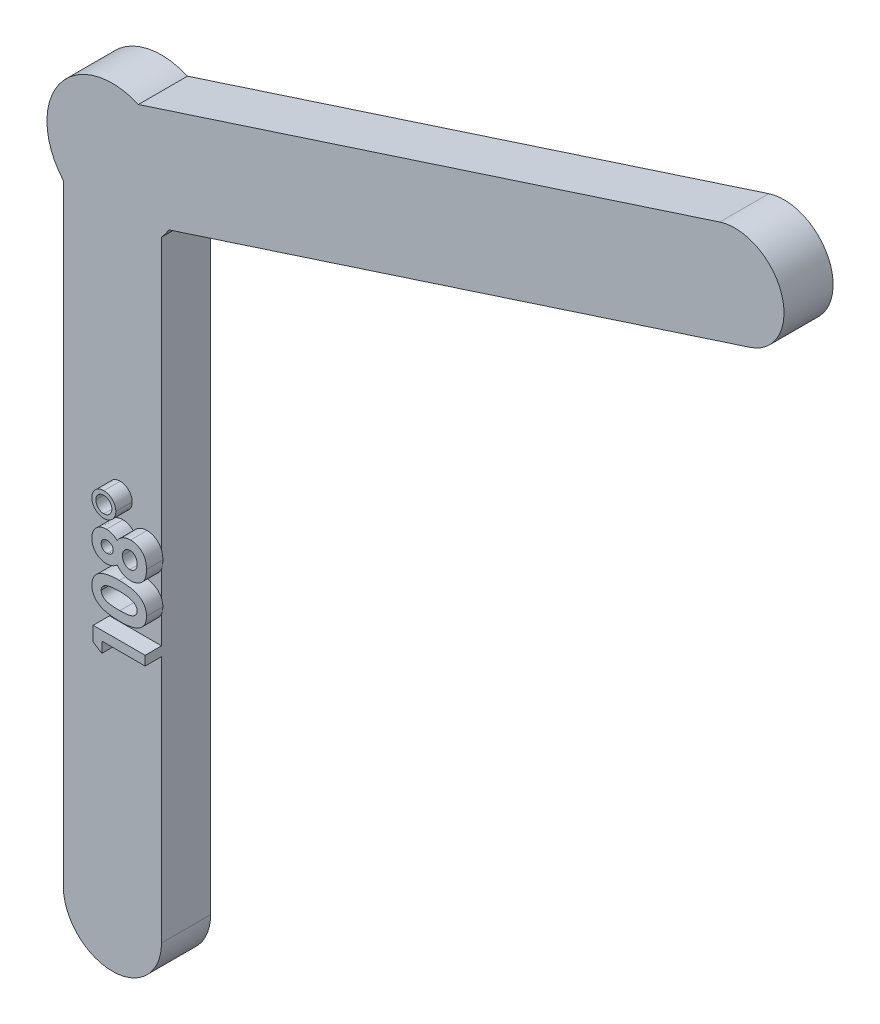
from build123d import *

# Parameters (mm, degrees)
BOSS_EXTRUDE1_DEPTH = 3
BOSS_EXTRUDE2_DEPTH = 1


with BuildPart() as part:
    # Sketch2 → Boss-Extrude1 (new body)
    with BuildSketch(Plane.XY):
        with BuildLine():
            Line((-3, -40), (-3, -2.645751311))
            ThreePointArc((-3, -2.645751311), (-3.236067977, 2.351141009), (1.589208042, 3.670751667))
            Line((1.589208042, 3.670751667), (37.115209669, 15.213849324))
            ThreePointArc((37.115209669, 15.213849324), (40.895430201, 13.287730758), (38.969311635, 9.507510226))
            Line((38.969311635, 9.507510226), (3.443310008, -2.035587431))
            ThreePointArc((3.443310008, -2.035587431), (3.236067977, -2.351141009), (3, -2.645751311))
            Line((3, -2.645751311), (3, -40))
            ThreePointArc((3, -40), (0, -43), (-3, -40))
        make_face()
    extrude(amount=BOSS_EXTRUDE1_DEPTH)

    # Sketch3 → Boss-Extrude2 (add)
    # profile 1 of 4: a face of its own
    with BuildSketch(Plane.XY.offset(3)):
        Polygon((-0.175, -25.154881865), (-0.175, -24.27399745), (3, -24.27399745), (3, -24.843869245), (0.354166667, -24.843869245), (0.354166667, -25.495151297), align=None)
    # profile 2 of 4: a face of its own
    with BuildSketch(Plane.XY.offset(3)):
        with BuildLine():
            add(Edge.make_bspline(
                [(-0.256410256, -22.187223612), (-0.256000846, -22.159639409), (-0.255195836, -22.105401495), (-0.246473924, -22.02552), (-0.233303758, -21.948569182), (-0.214913964, -21.874261296), (-0.19065475, -21.803082912), (-0.161374324, -21.734785029), (-0.126796317, -21.669429262), (-0.086761751, -21.606946387), (-0.040652473, -21.547894496), (0.010185802, -21.491318806), (0.067717809, -21.43948776), (0.130454644, -21.390835172), (0.198771401, -21.345693322), (0.272469109, -21.303770681), (0.352002612, -21.265485151), (0.437488797, -21.230380098), (0.530216664, -21.198990657), (0.631247648, -21.172550921), (0.740605462, -21.149874557), (0.858562124, -21.130734067), (0.985274483, -21.11626696), (1.120658341, -21.106515836), (1.264452704, -21.099824155), (1.363094454, -21.099278026), (1.413772035, -21.09899745)],
                knots=[0, 0, 0, 0, 0.879187688, 1.728717895, 2.558878706, 3.367146394, 4.166631857, 4.95393622, 5.734098362, 6.521634849, 7.316678452, 8.120609651, 8.943639266, 9.781961388, 10.650008082, 11.55217958, 12.483362701, 13.462505087, 14.497127373, 15.602264045, 16.790140859, 18.057036744, 19.411188506, 20.855078804, 22.384284574, 24, 24, 24, 24], degree=3))
            add(Edge.make_bspline(
                [(1.413772035, -21.09899745), (1.465083636, -21.099300727), (1.564781155, -21.099889987), (1.709890925, -21.106237126), (1.846257088, -21.117170742), (1.973869318, -21.131251658), (2.09264741, -21.150576911), (2.202741653, -21.173044562), (2.304172829, -21.200142384), (2.396949232, -21.232384739), (2.482667702, -21.267543829), (2.562361603, -21.305324879), (2.635439661, -21.347366311), (2.704216337, -21.389836589), (2.765684896, -21.437474644), (2.822263901, -21.486752984), (2.87178804, -21.540176006), (2.916848745, -21.595431785), (2.955788395, -21.654560868), (2.989844864, -21.716949245), (3.017468579, -21.783710325), (3.041494248, -21.853626861), (3.058742076, -21.927890678), (3.072427664, -22.005321711), (3.079991159, -22.086794149), (3.080929461, -22.142263866), (3.081410256, -22.170687154)],
                knots=[0, 0, 0, 0, 1.643824397, 3.193921316, 4.652018541, 6.026147715, 7.305813021, 8.506024873, 9.624771103, 10.66654028, 11.650369642, 12.592128821, 13.489360096, 14.35046321, 15.179132238, 15.977837183, 16.751455772, 17.509897991, 18.259653136, 19.016390304, 19.783391144, 20.571659993, 21.382176161, 22.223003704, 23.089447706, 24, 24, 24, 24], degree=3))
            add(Edge.make_bspline(
                [(3.081410256, -22.170687154), (3.080920089, -22.199109624), (3.079959859, -22.254788824), (3.072484978, -22.336482291), (3.058682809, -22.414321079), (3.041375575, -22.489181731), (3.017471846, -22.560488459), (2.989215292, -22.628874266), (2.954465748, -22.692986878), (2.915602853, -22.75414734), (2.870815661, -22.811389711), (2.820807888, -22.865562537), (2.766280514, -22.917423591), (2.705338818, -22.96512523), (2.639096011, -23.009520627), (2.567561271, -23.051080932), (2.490500768, -23.088961965), (2.40793533, -23.12443059), (2.317883816, -23.155810482), (2.21949947, -23.182869572), (2.112045503, -23.205788839), (1.995629446, -23.223802272), (1.870235813, -23.238328502), (1.735965212, -23.249100871), (1.592768059, -23.255486697), (1.494340976, -23.256069291), (1.443664864, -23.256369245)],
                knots=[0, 0, 0, 0, 0.917318694, 1.797013832, 2.644089644, 3.467281984, 4.274391433, 5.068665368, 5.852346333, 6.624865025, 7.405043053, 8.194438745, 9.002823433, 9.831034161, 10.688848002, 11.574933485, 12.499091769, 13.45866927, 14.473616003, 15.574277631, 16.749933499, 18.017757418, 19.374908438, 20.82337846, 22.364486432, 24, 24, 24, 24], degree=3))
            add(Edge.make_bspline(
                [(1.443664864, -23.256369245), (1.373254462, -23.255825542), (1.237396686, -23.25477646), (1.0411217, -23.241481718), (0.859699474, -23.22196841), (0.693433485, -23.193307983), (0.541707931, -23.15786976), (0.405522301, -23.112489271), (0.282992161, -23.060826886), (0.210404568, -23.016803896), (0.175445713, -22.995602018)],
                knots=[0, 0, 0, 0, 1.288568992, 2.486310467, 3.599230591, 4.627010532, 5.572937695, 6.447898582, 7.252493626, 8, 8, 8, 8], degree=3))
            add(Edge.make_bspline(
                [(0.175445713, -22.995602018), (0.141102145, -22.970949484), (0.073953702, -22.922748921), (-0.014199652, -22.838468891), (-0.089592717, -22.747920972), (-0.150519281, -22.649245361), (-0.198565973, -22.544002654), (-0.232500812, -22.431289289), (-0.252272829, -22.311521498), (-0.255010519, -22.229274958), (-0.256410256, -22.187223612)],
                knots=[0, 0, 0, 0, 1.058512271, 2.069600068, 3.047294572, 4.004278952, 4.967380941, 5.939006123, 6.946246673, 8, 8, 8, 8], degree=3))
        make_face()
        with BuildLine():
            add(Edge.make_bspline(
                [(0.313461538, -22.173231224), (0.314647089, -22.198164977), (0.316971398, -22.247048368), (0.336589396, -22.318024416), (0.367119772, -22.384663133), (0.402937146, -22.435915702), (0.437997174, -22.473843075), (0.469692245, -22.50046678), (0.505088209, -22.526130336), (0.5457633, -22.548770627), (0.590374583, -22.570366594), (0.639050565, -22.590819426), (0.692584041, -22.608406161), (0.750614615, -22.625179465), (0.814547313, -22.639686238), (0.884999784, -22.65237958), (0.962212565, -22.663193069), (1.046509296, -22.670991953), (1.137448259, -22.678152731), (1.235421604, -22.683308732), (1.340408748, -22.685459568), (1.412711585, -22.686144155), (1.45002504, -22.68649745)],
                knots=[0, 0, 0, 0, 1.076486532, 2.110485037, 3.16053299, 4.233735637, 4.798028448, 5.389657808, 6.0205397, 6.6857231, 7.399126456, 8.163539924, 8.966557062, 9.834164971, 10.774831688, 11.799768806, 12.928987201, 14.14492726, 15.459726247, 16.873396567, 18.386448164, 20, 20, 20, 20], degree=3))
            add(Edge.make_bspline(
                [(1.45002504, -22.68649745), (1.498366186, -22.685914523), (1.591063917, -22.684796717), (1.72437073, -22.678981137), (1.845884837, -22.667186388), (1.956076433, -22.652860272), (2.054303096, -22.632171296), (2.141437387, -22.608758289), (2.216697621, -22.579702468), (2.280987028, -22.546139154), (2.335677326, -22.508962718), (2.382164459, -22.468606882), (2.42242009, -22.42644467), (2.455119251, -22.381160293), (2.480178379, -22.33286173), (2.498203101, -22.281952199), (2.509236783, -22.228399345), (2.5107668, -22.191726903), (2.511538462, -22.173231224)],
                knots=[0, 0, 0, 0, 1.771738815, 3.39744054, 4.888007323, 6.245018868, 7.467093912, 8.564230264, 9.548241846, 10.417081984, 11.216594933, 11.965786359, 12.669352538, 13.348558586, 14.005353126, 14.656563323, 15.322440191, 16, 16, 16, 16], degree=3))
            add(Edge.make_bspline(
                [(2.511538462, -22.173231224), (2.511010434, -22.155370259), (2.50997662, -22.120400709), (2.499364668, -22.069407274), (2.482111937, -22.021184258), (2.457706739, -21.975877263), (2.426671795, -21.93332423), (2.388870725, -21.893733133), (2.34392674, -21.85740256), (2.310571656, -21.836236203), (2.293384415, -21.825329582)],
                knots=[0, 0, 0, 0, 0.992283464, 1.942767638, 2.88273346, 3.832339453, 4.79467288, 5.803907806, 6.868395428, 8, 8, 8, 8], degree=3))
            add(Edge.make_bspline(
                [(2.293384415, -21.825329582), (2.2698986, -21.812488872), (2.22065075, -21.785562945), (2.137546839, -21.754404216), (2.043819364, -21.728176534), (1.939176634, -21.705602752), (1.823205926, -21.690163662), (1.69664262, -21.676867537), (1.558849395, -21.670454485), (1.463385752, -21.669411367), (1.413772035, -21.668869245)],
                knots=[0, 0, 0, 0, 0.710965849, 1.490837728, 2.352621235, 3.297892224, 4.334225155, 5.461620853, 6.680770821, 8, 8, 8, 8], degree=3))
            add(Edge.make_bspline(
                [(1.413772035, -21.668869245), (1.363727648, -21.669078655), (1.267400744, -21.669481734), (1.129112143, -21.676877059), (1.002808457, -21.687175614), (0.88877167, -21.702239428), (0.786724952, -21.721621762), (0.696674974, -21.745510562), (0.618444263, -21.77367368), (0.552110828, -21.807071781), (0.495736507, -21.844062254), (0.447371712, -21.883328769), (0.406079071, -21.925037363), (0.371703192, -21.969118285), (0.345437441, -22.016591802), (0.326891649, -22.06655111), (0.315672066, -22.119098628), (0.314208327, -22.154943475), (0.313461538, -22.173231224)],
                knots=[0, 0, 0, 0, 1.793836731, 3.452829483, 4.963243077, 6.335886805, 7.574563692, 8.684454726, 9.672768357, 10.54971625, 11.340229787, 12.085688095, 12.778991901, 13.440269426, 14.083255152, 14.715733572, 15.344777694, 16, 16, 16, 16], degree=3))
        make_face(mode=Mode.SUBTRACT)
    # profile 3 of 4: a face of its own
    with BuildSketch(Plane.XY.offset(3)):
        with BuildLine():
            add(Edge.make_bspline(
                [(1.290384615, -19.051020688), (1.314166509, -19.017717364), (1.361240621, -18.951796441), (1.445595377, -18.865020774), (1.539140341, -18.789616624), (1.642399085, -18.727763317), (1.752431528, -18.677802774), (1.868089089, -18.642445048), (1.988052111, -18.619686169), (2.069615292, -18.617227529), (2.110847356, -18.61598463)],
                knots=[0, 0, 0, 0, 1.013621193, 2.006371702, 2.99000395, 3.985409788, 4.983103806, 5.979189713, 6.978433935, 8, 8, 8, 8], degree=3))
            add(Edge.make_bspline(
                [(2.110847356, -18.61598463), (2.155493061, -18.617489887), (2.244042089, -18.620475373), (2.373883227, -18.646936752), (2.498505826, -18.689197465), (2.616432852, -18.747499154), (2.724431839, -18.820252379), (2.820760825, -18.904585334), (2.901500204, -19.001764288), (2.956541404, -19.091887492), (2.992613836, -19.169755283), (3.017147677, -19.231991917), (3.036374539, -19.298589566), (3.053202037, -19.368555769), (3.065563353, -19.442765144), (3.075401317, -19.520595177), (3.080155908, -19.602600638), (3.08098502, -19.658413081), (3.081410256, -19.687038316)],
                knots=[0, 0, 0, 0, 1.313695232, 2.605545886, 3.885009818, 5.18064216, 6.467307036, 7.710187626, 8.938110693, 10.173834898, 10.807905002, 11.46418112, 12.141763502, 12.847499418, 13.582459421, 14.356129027, 15.156887083, 16, 16, 16, 16], degree=3))
            add(Edge.make_bspline(
                [(3.081410256, -19.687038316), (3.080993787, -19.717572186), (3.080180505, -19.777198813), (3.075321583, -19.864249357), (3.066194522, -19.946330762), (3.054699341, -20.02380978), (3.037672832, -20.095993684), (3.018972292, -20.163971967), (2.996206942, -20.227019384), (2.960636755, -20.303731559), (2.907185797, -20.392201597), (2.828023569, -20.487079082), (2.734597618, -20.571413966), (2.627697323, -20.643222676), (2.509788283, -20.701139127), (2.383511061, -20.7435029), (2.249446964, -20.768783032), (2.157597072, -20.771813817), (2.110847356, -20.773356425)],
                knots=[0, 0, 0, 0, 0.887120363, 1.732371145, 2.531576131, 3.285973923, 4.006155245, 4.684676743, 5.333503306, 5.950809733, 7.13915648, 8.324434623, 9.528022799, 10.783613014, 12.053458699, 13.333110172, 14.642607612, 16, 16, 16, 16], degree=3))
            add(Edge.make_bspline(
                [(2.110847356, -20.773356425), (2.070068436, -20.771941537), (1.989932921, -20.769161112), (1.872494733, -20.749302816), (1.761018818, -20.715036361), (1.654672452, -20.668536346), (1.553870674, -20.608226402), (1.459741575, -20.533585913), (1.370281849, -20.446635831), (1.317458785, -20.380490844), (1.290384615, -20.346588596)],
                knots=[0, 0, 0, 0, 1.018125035, 2.000738969, 2.963689272, 3.92372463, 4.892478514, 5.887985778, 6.917498794, 8, 8, 8, 8], degree=3))
            add(Edge.make_bspline(
                [(1.290384615, -20.346588596), (1.266151716, -20.367602223), (1.218444435, -20.408971725), (1.141646952, -20.462470619), (1.062364505, -20.507765328), (0.981097768, -20.545733804), (0.89711666, -20.574089031), (0.811521784, -20.59566383), (0.723184578, -20.607674163), (0.663516636, -20.609575532), (0.633378405, -20.610535912)],
                knots=[0, 0, 0, 0, 1.061588578, 2.089948196, 3.093099862, 4.082597858, 5.055037947, 6.023898163, 7.001872498, 8, 8, 8, 8], degree=3))
            add(Edge.make_bspline(
                [(0.633378405, -20.610535912), (0.592576327, -20.609275809), (0.512075397, -20.606789674), (0.394207452, -20.584507411), (0.28205246, -20.548021589), (0.176290436, -20.497791994), (0.079075037, -20.434587856), (-0.007396026, -20.358443966), (-0.081993722, -20.270641334), (-0.145475268, -20.172328027), (-0.195029291, -20.063625405), (-0.230531324, -19.946207535), (-0.252811348, -19.820808736), (-0.25519237, -19.734410725), (-0.256410256, -19.690218404)],
                knots=[0, 0, 0, 0, 1.02226196, 2.016883474, 2.9952073, 3.972418565, 4.944004294, 5.893096802, 6.850754418, 7.823909284, 8.818133006, 9.835407617, 10.892817559, 12, 12, 12, 12], degree=3))
            add(Edge.make_bspline(
                [(-0.256410256, -19.690218404), (-0.255190422, -19.646662662), (-0.252812, -19.561738085), (-0.230679106, -19.438541783), (-0.194395909, -19.323670332), (-0.143773179, -19.217368046), (-0.08015754, -19.120077541), (-0.003012872, -19.033777327), (0.085649386, -18.957869341), (0.185372183, -18.894140442), (0.292865784, -18.842893718), (0.405795355, -18.805448662), (0.522920147, -18.783490726), (0.602336048, -18.780373249), (0.642282652, -18.778805143)],
                knots=[0, 0, 0, 0, 1.094451292, 2.133950859, 3.135435022, 4.115505557, 5.085475983, 6.048403322, 7.01637925, 8.011600517, 9.015508126, 10.003420448, 10.995710276, 12, 12, 12, 12], degree=3))
            add(Edge.make_bspline(
                [(0.642282652, -18.778805143), (0.670513068, -18.779563838), (0.725913147, -18.78105272), (0.807533099, -18.792061213), (0.885847553, -18.810598164), (0.962749047, -18.836442872), (1.040327423, -18.872375838), (1.120069223, -18.921001495), (1.205287736, -18.980148223), (1.261061511, -19.026599103), (1.290384615, -19.051020688)],
                knots=[0, 0, 0, 0, 0.940746401, 1.846144481, 2.739104268, 3.619506754, 4.545839139, 5.581956076, 6.728711598, 8, 8, 8, 8], degree=3))
        make_face()
        with BuildLine():
            add(Edge.make_bspline(
                [(0.313461538, -19.704210792), (0.314577296, -19.727681709), (0.316747691, -19.773337828), (0.336791099, -19.838249913), (0.368396801, -19.897141705), (0.413289247, -19.947823253), (0.468001453, -19.988958984), (0.530415435, -20.019695609), (0.600152328, -20.03775339), (0.648960581, -20.039675008), (0.674083534, -20.040664117)],
                knots=[0, 0, 0, 0, 1.01773081, 1.979711282, 2.923920718, 3.903393177, 4.896680191, 5.881555186, 6.909578104, 8, 8, 8, 8], degree=3))
            add(Edge.make_bspline(
                [(0.674083534, -20.040664117), (0.699424417, -20.03944688), (0.748904934, -20.037070107), (0.819934691, -20.018349127), (0.884396564, -19.986516514), (0.940626067, -19.942450413), (0.987659679, -19.889931078), (1.021570733, -19.829582595), (1.04308292, -19.763530046), (1.045116089, -19.717098031), (1.046153846, -19.693398492)],
                knots=[0, 0, 0, 0, 1.070748338, 2.090739333, 3.08117878, 4.090911184, 5.094654374, 6.042199979, 7.000711936, 8, 8, 8, 8], degree=3))
            add(Edge.make_bspline(
                [(1.046153846, -19.693398492), (1.045059816, -19.669297424), (1.042928441, -19.622344023), (1.022508887, -19.555369246), (0.988689983, -19.495573894), (0.94229789, -19.444111814), (0.886359471, -19.401065933), (0.820898298, -19.370216145), (0.747532717, -19.352293405), (0.696233661, -19.349911913), (0.66963141, -19.348676938)],
                knots=[0, 0, 0, 0, 1.009150293, 1.966014103, 2.906107826, 3.870180916, 4.854078599, 5.848854597, 6.884476363, 8, 8, 8, 8], degree=3))
            add(Edge.make_bspline(
                [(0.66963141, -19.348676938), (0.644523092, -19.349946247), (0.595964488, -19.352401046), (0.526250213, -19.370002897), (0.464864053, -19.402329577), (0.410961323, -19.444802663), (0.367492124, -19.498052531), (0.335524613, -19.559871727), (0.316983147, -19.629805041), (0.314660828, -19.678871787), (0.313461538, -19.704210792)],
                knots=[0, 0, 0, 0, 1.065910571, 2.061433587, 3.023559535, 3.990682701, 4.956464619, 5.918590567, 6.925120432, 8, 8, 8, 8], degree=3))
        make_face(mode=Mode.SUBTRACT)
        with BuildLine():
            add(Edge.make_bspline(
                [(1.616025641, -19.685766281), (1.616315036, -19.703598422), (1.616885429, -19.73874535), (1.623711201, -19.790376643), (1.633401384, -19.840126914), (1.648498508, -19.88712446), (1.666134775, -19.932614345), (1.689165374, -19.975448281), (1.715918448, -20.016360178), (1.74640318, -20.054467234), (1.779830517, -20.088917867), (1.814702344, -20.119969165), (1.851910211, -20.14534988), (1.890219827, -20.166485794), (1.929934133, -20.183468663), (1.971707306, -20.194695613), (2.014983002, -20.2019242), (2.044460653, -20.202961427), (2.059329928, -20.20348463)],
                knots=[0, 0, 0, 0, 1.129662435, 2.226550525, 3.296682235, 4.33815786, 5.351414921, 6.385493299, 7.41431807, 8.4469981, 9.473537958, 10.454642902, 11.401552439, 12.321859429, 13.225429467, 14.131893492, 15.057679712, 16, 16, 16, 16], degree=3))
            add(Edge.make_bspline(
                [(2.059329928, -20.20348463), (2.074837113, -20.203235262), (2.105593696, -20.202740671), (2.150485415, -20.195270575), (2.193780386, -20.184514952), (2.235073386, -20.16940835), (2.274340207, -20.149206087), (2.311963245, -20.125084417), (2.347676229, -20.096201288), (2.381297203, -20.063343471), (2.411600958, -20.026547989), (2.438404735, -19.986932473), (2.461677906, -19.944755121), (2.479861546, -19.899615267), (2.49411916, -19.851691996), (2.503888336, -19.801193441), (2.510720881, -19.74785651), (2.511261264, -19.711441894), (2.511538462, -19.692762474)],
                knots=[0, 0, 0, 0, 0.973751152, 1.931314908, 2.852573969, 3.776047714, 4.688004804, 5.623328242, 6.580799242, 7.570383313, 8.573782212, 9.57185612, 10.573837789, 11.596003268, 12.62492379, 13.712263769, 14.826471634, 16, 16, 16, 16], degree=3))
            add(Edge.make_bspline(
                [(2.511538462, -19.692762474), (2.511196157, -19.673878018), (2.510529115, -19.637078193), (2.504633754, -19.583284228), (2.495279457, -19.532404762), (2.481900889, -19.484500212), (2.464761533, -19.439390689), (2.442949692, -19.397676758), (2.418219634, -19.358422595), (2.389368786, -19.322829552), (2.357892778, -19.290618983), (2.323956282, -19.262238093), (2.287463312, -19.238478497), (2.248401199, -19.219596335), (2.207627439, -19.204064059), (2.164524234, -19.193264276), (2.119106345, -19.186745793), (2.087973171, -19.18615737), (2.07205028, -19.185856425)],
                knots=[0, 0, 0, 0, 1.200550576, 2.339492856, 3.436821733, 4.486835684, 5.498320788, 6.499238723, 7.475334368, 8.44385928, 9.406737867, 10.335409062, 11.251568017, 12.168024507, 13.089524389, 14.021419298, 14.988065767, 16, 16, 16, 16], degree=3))
            add(Edge.make_bspline(
                [(2.07205028, -19.185856425), (2.056133401, -19.186438247), (2.025021417, -19.187575509), (1.979077259, -19.19379844), (1.935521469, -19.205472018), (1.893343926, -19.220744483), (1.853417246, -19.24106031), (1.81582637, -19.266282191), (1.779637539, -19.294990049), (1.746471676, -19.328546456), (1.716116677, -19.365222977), (1.689182565, -19.404304091), (1.666011589, -19.445389594), (1.64851655, -19.489488572), (1.633396343, -19.535201471), (1.62371115, -19.583692682), (1.616884013, -19.634054263), (1.616314611, -19.668357483), (1.616025641, -19.685766281)],
                knots=[0, 0, 0, 0, 1.011783362, 1.977685852, 2.938313235, 3.871729441, 4.823627117, 5.776382316, 6.744161804, 7.753880392, 8.768082256, 9.765777265, 10.766741032, 11.757408326, 12.775628261, 13.821889533, 14.89461443, 16, 16, 16, 16], degree=3))
        make_face(mode=Mode.SUBTRACT)
    # profile 4 of 4: a face of its own
    with BuildSketch(Plane.XY.offset(3)):
        with BuildLine():
            add(Edge.make_bspline(
                [(0.476282051, -16.824958989), (0.501543872, -16.825505484), (0.55122174, -16.826580176), (0.624352745, -16.837013476), (0.694208258, -16.854492691), (0.761803607, -16.876903338), (0.825395964, -16.908042089), (0.886396731, -16.944903837), (0.943669883, -16.989402672), (0.9978957, -17.039014969), (1.047295391, -17.093515132), (1.090947065, -17.151405488), (1.127096601, -17.212864468), (1.157366856, -17.276577248), (1.180332148, -17.343408663), (1.196689885, -17.412864586), (1.20741609, -17.485236986), (1.208449037, -17.534503871), (1.208974359, -17.559559349)],
                knots=[0, 0, 0, 0, 1.048753193, 2.062393874, 3.059725798, 4.03711221, 5.013824111, 5.993903926, 6.992478922, 8.020738441, 9.043061753, 10.043343452, 11.026424807, 11.999358773, 12.968420071, 13.955122655, 14.960044262, 16, 16, 16, 16], degree=3))
            add(Edge.make_bspline(
                [(1.208974359, -17.559559349), (1.208454225, -17.584616682), (1.207431478, -17.633887214), (1.196631189, -17.706233128), (1.180530583, -17.775855144), (1.156529218, -17.842391691), (1.126678292, -17.90615653), (1.090260147, -17.967072817), (1.046482503, -18.024600993), (0.996781055, -18.078582797), (0.942375086, -18.128107638), (0.88420218, -18.171482912), (0.823225465, -18.208946116), (0.758107997, -18.237837437), (0.69067286, -18.261947038), (0.619758864, -18.27798784), (0.545943315, -18.288833106), (0.495615647, -18.289833085), (0.469921875, -18.290343604)],
                knots=[0, 0, 0, 0, 1.037227242, 2.039512271, 3.023626077, 3.993053151, 4.963434463, 5.936395473, 6.927031705, 7.952593414, 8.972234493, 9.969891786, 10.954906455, 11.929570282, 12.915563215, 13.916770353, 14.936449251, 16, 16, 16, 16], degree=3))
            add(Edge.make_bspline(
                [(0.469921875, -18.290343604), (0.445290866, -18.289811451), (0.396869022, -18.288765297), (0.325492116, -18.278103661), (0.256787066, -18.261182775), (0.190979117, -18.23681523), (0.128167681, -18.205730248), (0.067236284, -18.169180135), (0.010175979, -18.123937412), (-0.044275745, -18.073515722), (-0.093962638, -18.018218509), (-0.137555056, -17.95952238), (-0.173973759, -17.89802202), (-0.203993097, -17.834134423), (-0.227847104, -17.767768562), (-0.244158222, -17.698411219), (-0.254789074, -17.626671533), (-0.255866772, -17.577830012), (-0.256410256, -17.553199173)],
                knots=[0, 0, 0, 0, 1.027628768, 2.020204677, 3.0054932, 3.977172113, 4.942988595, 5.928118098, 6.937247537, 7.976812879, 9.023474825, 10.036014018, 11.024160528, 12.002107364, 12.979092523, 13.962271943, 14.972371232, 16, 16, 16, 16], degree=3))
            add(Edge.make_bspline(
                [(-0.256410256, -17.553199173), (-0.255881051, -17.528566172), (-0.254836181, -17.479930408), (-0.244068832, -17.408427146), (-0.227959354, -17.339440503), (-0.203981879, -17.27352423), (-0.173948227, -17.210285117), (-0.137706982, -17.149501332), (-0.093944483, -17.091941849), (-0.043999627, -17.038019265), (0.009956511, -16.987787182), (0.068273488, -16.944627592), (0.128824771, -16.907104674), (0.192846684, -16.877455064), (0.259342082, -16.853394895), (0.329176204, -16.837233977), (0.401748506, -16.826543556), (0.451226198, -16.825491671), (0.476282051, -16.824958989)],
                knots=[0, 0, 0, 0, 1.02774298, 2.029191086, 3.012479778, 3.981238486, 4.951290381, 5.931946007, 6.930416638, 7.964088953, 8.997761269, 10.003308488, 10.98854748, 11.966603007, 12.943696749, 13.935593372, 14.954569896, 16, 16, 16, 16], degree=3))
        make_face()
        with BuildLine():
            add(Edge.make_bspline(
                [(0.479462139, -17.069189758), (0.462471258, -17.069424264), (0.428972226, -17.069886612), (0.379883793, -17.077505977), (0.332524379, -17.088023775), (0.287283463, -17.10328392), (0.24427911, -17.123234284), (0.203398935, -17.147571829), (0.164484674, -17.176174899), (0.128492582, -17.209237523), (0.095853701, -17.245103846), (0.066652511, -17.282897251), (0.042455186, -17.323086522), (0.023016589, -17.365273093), (0.006315159, -17.408801858), (-0.003707976, -17.454711924), (-0.01154919, -17.502263298), (-0.011966436, -17.534718897), (-0.012179487, -17.55129112)],
                knots=[0, 0, 0, 0, 1.061159961, 2.092171217, 3.098605391, 4.092036902, 5.070589041, 6.057187883, 7.061962211, 8.084674938, 9.107387665, 10.090954379, 11.06617917, 12.032717429, 12.99305519, 13.973669989, 14.965331307, 16, 16, 16, 16], degree=3))
            add(Edge.make_bspline(
                [(-0.012179487, -17.55129112), (-0.01157068, -17.568051412), (-0.01036426, -17.601263796), (-0.004409395, -17.650200831), (0.007572839, -17.69685371), (0.022606002, -17.742054962), (0.043122897, -17.784898142), (0.067542797, -17.826391236), (0.096744971, -17.865435361), (0.129769422, -17.902214665), (0.165718261, -17.935960463), (0.204573602, -17.964950546), (0.244977971, -17.990352408), (0.287582445, -18.010455361), (0.331832846, -18.026567734), (0.377821945, -18.038209426), (0.425871214, -18.044356322), (0.458458137, -18.045521173), (0.475010016, -18.046112835)],
                knots=[0, 0, 0, 0, 1.042034071, 2.064906527, 3.055369705, 4.030203466, 5.020228521, 6.000742353, 7.017744738, 8.043920206, 9.069249762, 10.075703201, 11.051782302, 12.029903876, 12.99669358, 13.974371501, 14.971122288, 16, 16, 16, 16], degree=3))
            add(Edge.make_bspline(
                [(0.475010016, -18.046112835), (0.491349767, -18.045520146), (0.523514051, -18.044353455), (0.570936909, -18.038223162), (0.616468237, -18.026465839), (0.660506807, -18.010425399), (0.703332854, -17.990458383), (0.743356347, -17.964229259), (0.782721478, -17.935019181), (0.819574977, -17.900938323), (0.853594861, -17.864058718), (0.883277913, -17.824563201), (0.908722399, -17.783622403), (0.929101491, -17.740636346), (0.945194342, -17.696373754), (0.956841315, -17.650387952), (0.962986781, -17.60233779), (0.964151827, -17.56975099), (0.96474359, -17.553199173)],
                knots=[0, 0, 0, 0, 1.017878107, 2.003660885, 2.970612419, 3.939454555, 4.919652619, 5.904816436, 6.913406512, 7.969270601, 9.02513469, 10.033724766, 11.041277553, 12.021475617, 12.990317753, 13.970071221, 14.968938047, 16, 16, 16, 16], degree=3))
            add(Edge.make_bspline(
                [(0.96474359, -17.553199173), (0.964515736, -17.536840687), (0.964066668, -17.504600367), (0.956359019, -17.457448889), (0.946146284, -17.411789288), (0.929505189, -17.368485652), (0.910263551, -17.326033898), (0.884925795, -17.286252494), (0.856415485, -17.247396305), (0.822504018, -17.212069657), (0.787116244, -17.177952839), (0.747777121, -17.149765554), (0.707718654, -17.124520148), (0.665616684, -17.10387006), (0.621397497, -17.089062601), (0.575848465, -17.07693948), (0.528165265, -17.071009446), (0.49579822, -17.069800121), (0.479462139, -17.069189758)],
                knots=[0, 0, 0, 0, 1.029744634, 2.029484694, 3.00508751, 3.97324883, 4.947661161, 5.937798898, 6.940036528, 7.980134083, 9.020231638, 10.033191535, 11.023329272, 12.003497406, 12.979740652, 13.958541426, 14.969648588, 16, 16, 16, 16], degree=3))
        make_face(mode=Mode.SUBTRACT)
    extrude(amount=BOSS_EXTRUDE2_DEPTH)


solid = part.part
